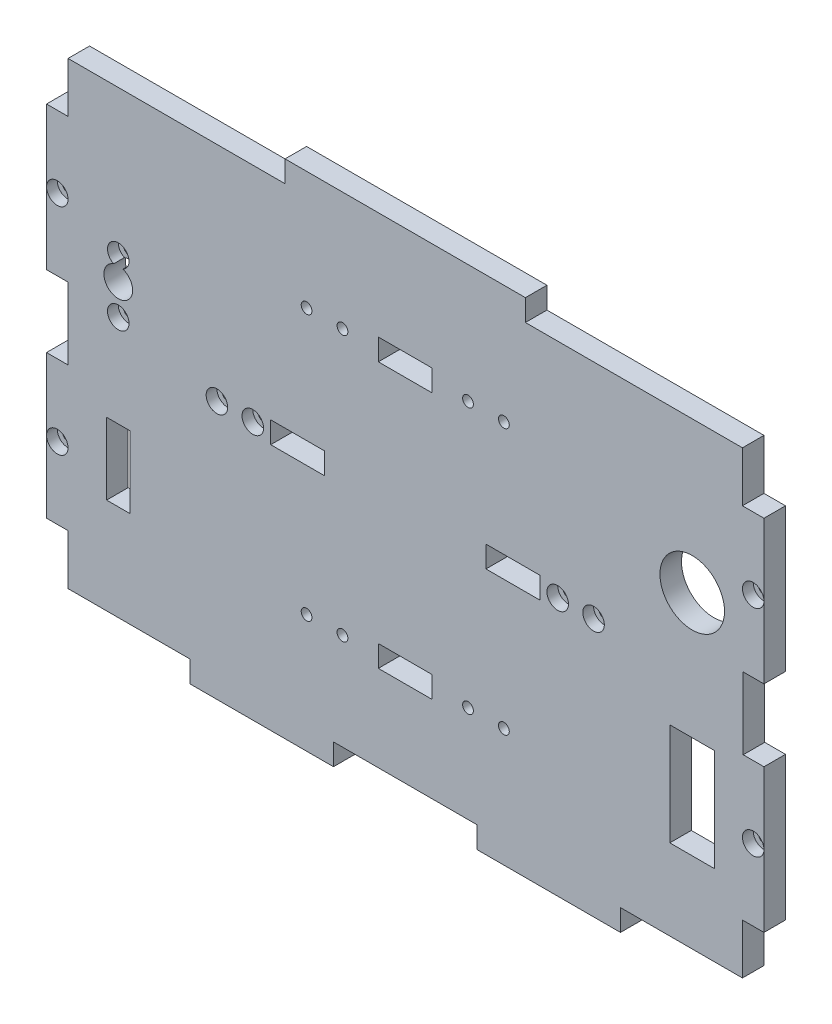
from build123d import *

# Parameters (mm, degrees)
ESQUISSE1_W              = 200
ESQUISSE1_H              = 140
BOSS_EXTRU_1_DEPTH       = 6
ESQUISSE2_R              = 9
ESQUISSE2_R_2            = 4
ESQUISSE2_W              = 6.5
ESQUISSE2_H              = 20
ESQUISSE2_W_2            = 12.5
ESQUISSE2_H_2            = 28.5
ENL_V_MAT_EXTRU_1_DEPTH  = 245.204832057
ESQUISSE3_W              = 40
ESQUISSE3_H              = 6
ESQUISSE3_W_2            = 66.5
ENL_V_MAT_EXTRU_2_DEPTH  = 6
ESQUISSE7_W              = 6
ESQUISSE7_H              = 128
ESQUISSE7_H_2            = 14
ESQUISSE7_R              = 1.5
ENL_V_MAT_EXTRU_4_DEPTH  = 6
ESQUISSE9_W              = 5.785245128
ESQUISSE9_H              = 20
ENL_V_MAT_EXTRU_5_DEPTH  = 6
ESQUISSE12_W             = 6
ESQUISSE12_H             = 40
BOSS_EXTRU_2_DEPTH       = 6
ESQUISSE13_R             = 1.5
ENL_V_MAT_EXTRU_7_DEPTH  = 6
ESQUISSE14_R             = 1.5
ESQUISSE14_W             = 15
ESQUISSE14_H             = 6
ENL_V_MAT_EXTRU_8_DEPTH  = 245.204832057
ESQUISSE15_R             = 1.5
ENL_V_MAT_EXTRU_9_DEPTH  = 245.204832057
ESQUISSE17_R             = 3
ENL_V_MAT_EXTRU_12_DEPTH = 3
ESQUISSE18_R             = 1.5
ESQUISSE18_W             = 15
ESQUISSE18_H             = 6
ENL_V_MAT_EXTRU_13_DEPTH = 245.204832057
ESQUISSE16_R             = 2.995
ESQUISSE16_R_2           = 3
ENL_V_MAT_EXTRU_11_DEPTH = 3


with BuildPart() as part:
    # Esquisse1 → Boss.-Extru.1 (new body)
    with BuildSketch(Plane.XY):
        with Locations((-100, 70)):
            Rectangle(ESQUISSE1_W, ESQUISSE1_H)
    extrude(amount=BOSS_EXTRU_1_DEPTH)

    # Esquisse2 → Enlèv. mat.-Extru.1 (cut, through all)
    with BuildSketch(Plane.XY.offset(6)):
        with Locations((-20, 92)):
            Circle(ESQUISSE2_R)
        with Locations((-180, 87)):
            Circle(ESQUISSE2_R_2)
        with Locations((-180, 42.75)):
            Rectangle(ESQUISSE2_W, ESQUISSE2_H)
        with Locations((-20, 42.75)):
            Rectangle(ESQUISSE2_W_2, ESQUISSE2_H_2)
    extrude(amount=-ENL_V_MAT_EXTRU_1_DEPTH, mode=Mode.SUBTRACT)

    # Esquisse3 → Enlèv. mat.-Extru.2 (cut)
    with BuildSketch(Plane.XY.offset(6)):
        with Locations((-180, 3)):
            Rectangle(ESQUISSE3_W, ESQUISSE3_H)
        with Locations((-100, 3)):
            Rectangle(ESQUISSE3_W, ESQUISSE3_H)
        with Locations((-20, 3)):
            Rectangle(ESQUISSE3_W, ESQUISSE3_H)
        with Locations((-166.75, 137)):
            Rectangle(ESQUISSE3_W_2, ESQUISSE3_H)
        with Locations((-33.25, 137)):
            Rectangle(ESQUISSE3_W_2, ESQUISSE3_H)
    extrude(amount=-ENL_V_MAT_EXTRU_2_DEPTH, mode=Mode.SUBTRACT)

    # Esquisse7 → Enlèv. mat.-Extru.4 (cut)
    with BuildSketch(Plane.XY.offset(6)):
        with Locations((-197, 70)):
            Rectangle(ESQUISSE7_W, ESQUISSE7_H)
        with Locations((-3, 127)):
            Rectangle(ESQUISSE7_W, ESQUISSE7_H_2)
        with Locations((-3, 13)):
            Rectangle(ESQUISSE7_W, ESQUISSE7_H_2)
        with Locations((-3, 40)):
            Circle(ESQUISSE7_R)
        with Locations((-3, 100)):
            Circle(ESQUISSE7_R)
    extrude(amount=-ENL_V_MAT_EXTRU_4_DEPTH, mode=Mode.SUBTRACT)

    # Esquisse9 → Enlèv. mat.-Extru.5 (cut)
    with BuildSketch(Plane.XY.offset(6)):
        with Locations((-2.892622564, 70)):
            Rectangle(ESQUISSE9_W, ESQUISSE9_H)
    extrude(amount=-ENL_V_MAT_EXTRU_5_DEPTH, mode=Mode.SUBTRACT)

    # Esquisse12 → Boss.-Extru.2 (add)
    with BuildSketch(Plane.XY.offset(6)):
        with Locations((-197, 100)):
            Rectangle(ESQUISSE12_W, ESQUISSE12_H)
        with Locations((-197, 40)):
            Rectangle(ESQUISSE12_W, ESQUISSE12_H)
    extrude(amount=-BOSS_EXTRU_2_DEPTH)

    # Esquisse13 → Enlèv. mat.-Extru.7 (cut)
    with BuildSketch(Plane.XY.offset(6)):
        with Locations((-197, 100)):
            Circle(ESQUISSE13_R)
        with Locations((-197, 40)):
            Circle(ESQUISSE13_R)
    extrude(amount=-ENL_V_MAT_EXTRU_7_DEPTH, mode=Mode.SUBTRACT)

    # Esquisse14 → Enlèv. mat.-Extru.8 (cut, through all)
    with BuildSketch(Plane.XY.offset(6)):
        with Locations((-152.5, 72)):
            Circle(ESQUISSE14_R)
        with Locations((-142.5, 72)):
            Circle(ESQUISSE14_R)
        with Locations((-57.5, 72)):
            Circle(ESQUISSE14_R)
        with Locations((-47.5, 72)):
            Circle(ESQUISSE14_R)
        with Locations((-70, 72)):
            Rectangle(ESQUISSE14_W, ESQUISSE14_H)
        with Locations((-130, 72)):
            Rectangle(ESQUISSE14_W, ESQUISSE14_H)
    extrude(amount=-ENL_V_MAT_EXTRU_8_DEPTH, mode=Mode.SUBTRACT)

    # Esquisse15 → Enlèv. mat.-Extru.9 (cut, through all)
    with BuildSketch(Plane.XY.offset(6)):
        with Locations((-180, 93.5)):
            Circle(ESQUISSE15_R)
        with Locations((-180, 78.5)):
            Circle(ESQUISSE15_R)
    extrude(amount=-ENL_V_MAT_EXTRU_9_DEPTH, mode=Mode.SUBTRACT)

    # Esquisse17 → Enlèv. mat.-Extru.12 (cut)
    with BuildSketch(Plane.XY.offset(6)):
        with Locations((-180, 93.5)):
            Circle(ESQUISSE17_R)
        with Locations((-180, 78.5)):
            Circle(ESQUISSE17_R)
    extrude(amount=-ENL_V_MAT_EXTRU_12_DEPTH, mode=Mode.SUBTRACT)

    # Esquisse18 → Enlèv. mat.-Extru.13 (cut, through all)
    with BuildSketch(Plane.XY.offset(6)):
        with Locations((-117.5, 107)):
            Circle(ESQUISSE18_R)
        with Locations((-82.5, 107)):
            Circle(ESQUISSE18_R)
        with Locations((-117.5, 33)):
            Circle(ESQUISSE18_R)
        with Locations((-82.5, 33)):
            Circle(ESQUISSE18_R)
        with Locations((-127.5, 107)):
            Circle(ESQUISSE18_R)
        with Locations((-72.5, 107)):
            Circle(ESQUISSE18_R)
        with Locations((-72.5, 33)):
            Circle(ESQUISSE18_R)
        with Locations((-127.5, 33)):
            Circle(ESQUISSE18_R)
        with Locations((-100, 107)):
            Rectangle(ESQUISSE18_W, ESQUISSE18_H)
        with Locations((-100, 33)):
            Rectangle(ESQUISSE18_W, ESQUISSE18_H)
    extrude(amount=-ENL_V_MAT_EXTRU_13_DEPTH, mode=Mode.SUBTRACT)

    # Esquisse16 → Enlèv. mat.-Extru.11 (cut)
    with BuildSketch(Plane.XY.offset(6)):
        with Locations((-197, 100)):
            Circle(ESQUISSE16_R)
        with Locations((-142.5, 72)):
            Circle(ESQUISSE16_R_2)
        with Locations((-152.5, 72)):
            Circle(ESQUISSE16_R_2)
        with Locations((-57.5, 72)):
            Circle(ESQUISSE16_R_2)
        with Locations((-197, 40)):
            Circle(ESQUISSE16_R)
        with Locations(Location((-3, 40, 0), (0, 0, 180))):
            Circle(ESQUISSE16_R)
        with Locations(Location((-47.5, 72, 0), (0, 0, 180))):
            Circle(ESQUISSE16_R_2)
        with Locations(Location((-3, 100, 0), (0, 0, 180))):
            Circle(ESQUISSE16_R)
    extrude(amount=-ENL_V_MAT_EXTRU_11_DEPTH, mode=Mode.SUBTRACT)


solid = part.part
